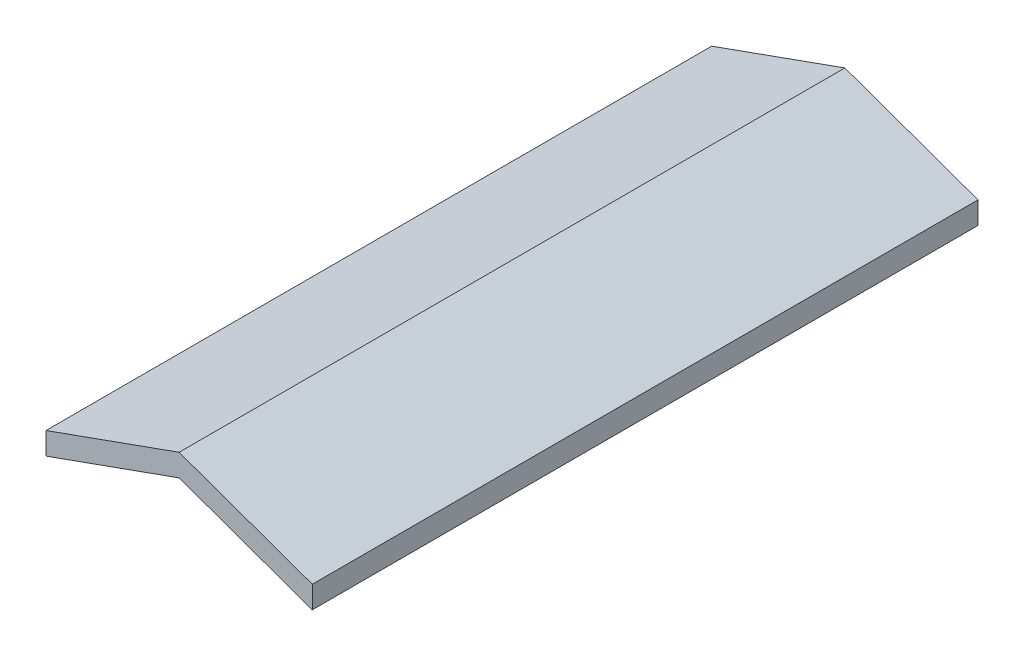
from build123d import *

# Parameters (mm, degrees)
EXTRUDE_1_DEPTH = 30000


with BuildPart() as part:
    # ｽｹｯﾁ1 → ﾎﾞｽ - 押し出し1 (new body)
    with BuildSketch(Plane.XY):
        Polygon((0, 0), (-6000, -2150), (-6000, -3150), (0, -1000), (6000, -3150), (6000, -2150), align=None)
    extrude(amount=EXTRUDE_1_DEPTH)


solid = part.part
